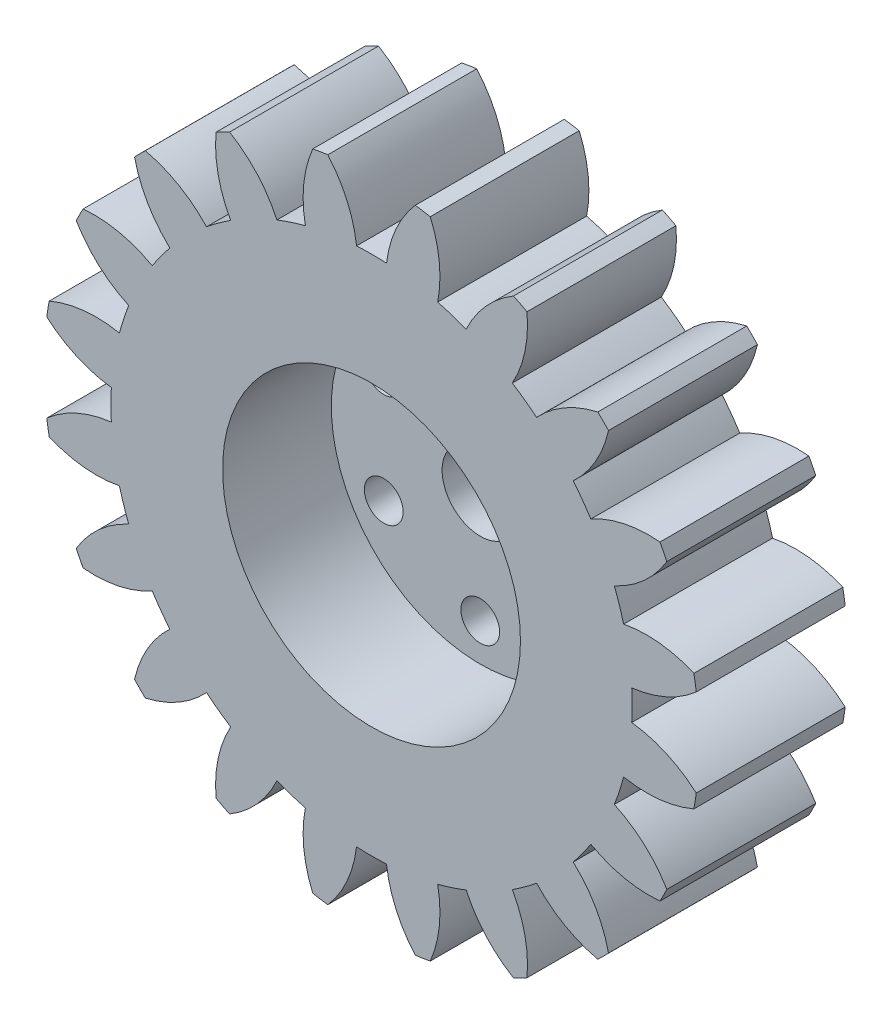
from build123d import *

# Parameters (mm, degrees)
SKETCH1_R           = 3.25
BOSS_EXTRUDE1_DEPTH = 12.7
CUT_EXTRUDE1_REACH  = 43.167
SKETCH2_R           = 1.651
SKETCH3_R           = 12.7
CUT_EXTRUDE2_DEPTH  = 9.271


with BuildPart() as part:
    # Sketch1 → Boss-Extrude1 (new body)
    with BuildSketch(Plane.XY):
        with BuildLine():
            ThreePointArc((-27.689807384, 3.730705969), (-25.124393342, 2.086949602), (-22.186968024, 1.277742146))
            ThreePointArc((-22.186968024, 1.277742146), (-22.22373, 0), (-22.186968024, -1.277742146))
            ThreePointArc((-22.186968024, -1.277742146), (-25.124393342, -2.086949602), (-27.689807384, -3.730705969))
            ThreePointArc((-27.689807384, -3.730705969), (-27.596012236, -4.370778953), (-27.487423293, -5.00850883))
            ThreePointArc((-27.487423293, -5.00850883), (-24.539620899, -5.779057498), (-21.495904554, -5.640945179))
            ThreePointArc((-21.495904554, -5.640945179), (-21.136023233, -6.867510248), (-20.706216479, -8.071355168))
            ThreePointArc((-20.706216479, -8.071355168), (-23.249815112, -9.748671534), (-25.181720202, -12.104733275))
            ThreePointArc((-25.181720202, -12.104733275), (-24.894722286, -12.684494563), (-24.594378694, -13.257455889))
            ThreePointArc((-24.594378694, -13.257455889), (-21.552739385, -13.079370185), (-18.700672175, -12.007457487))
            ThreePointArc((-18.700672175, -12.007457487), (-17.979375248, -13.062780745), (-17.198596196, -14.074887709))
            ThreePointArc((-17.198596196, -14.074887709), (-19.099382988, -16.456125574), (-20.208670796, -19.293864949))
            ThreePointArc((-20.208670796, -19.293864949), (-19.756563466, -19.756563466), (-19.293864949, -20.208670796))
            ThreePointArc((-19.293864949, -20.208670796), (-16.456125574, -19.099382988), (-14.074887709, -17.198596196))
            ThreePointArc((-14.074887709, -17.198596196), (-13.062780745, -17.979375248), (-12.007457487, -18.700672175))
            ThreePointArc((-12.007457487, -18.700672175), (-13.079370185, -21.552739385), (-13.257455889, -24.594378694))
            ThreePointArc((-13.257455889, -24.594378694), (-12.684494563, -24.894722286), (-12.104733275, -25.181720202))
            ThreePointArc((-12.104733275, -25.181720202), (-9.748671534, -23.249815112), (-8.071355168, -20.706216479))
            ThreePointArc((-8.071355168, -20.706216479), (-6.867510248, -21.136023233), (-5.640945179, -21.495904554))
            ThreePointArc((-5.640945179, -21.495904554), (-5.779057498, -24.539620899), (-5.00850883, -27.487423293))
            ThreePointArc((-5.00850883, -27.487423293), (-4.370778953, -27.596012236), (-3.730705969, -27.689807384))
            ThreePointArc((-3.730705969, -27.689807384), (-2.086949602, -25.124393342), (-1.277742146, -22.186968024))
            ThreePointArc((-1.277742146, -22.186968024), (0, -22.22373), (1.277742146, -22.186968024))
            ThreePointArc((1.277742146, -22.186968024), (2.086949602, -25.124393342), (3.730705969, -27.689807384))
            ThreePointArc((3.730705969, -27.689807384), (4.370778953, -27.596012236), (5.00850883, -27.487423293))
            ThreePointArc((5.00850883, -27.487423293), (5.779057498, -24.539620899), (5.640945179, -21.495904554))
            ThreePointArc((5.640945179, -21.495904554), (6.867510248, -21.136023233), (8.071355168, -20.706216479))
            ThreePointArc((8.071355168, -20.706216479), (9.748671534, -23.249815112), (12.104733275, -25.181720202))
            ThreePointArc((12.104733275, -25.181720202), (12.684494563, -24.894722286), (13.257455889, -24.594378694))
            ThreePointArc((13.257455889, -24.594378694), (13.079370185, -21.552739385), (12.007457487, -18.700672175))
            ThreePointArc((12.007457487, -18.700672175), (13.062780745, -17.979375248), (14.074887709, -17.198596196))
            ThreePointArc((14.074887709, -17.198596196), (16.456125574, -19.099382988), (19.293864949, -20.208670796))
            ThreePointArc((19.293864949, -20.208670796), (19.756563466, -19.756563466), (20.208670796, -19.293864949))
            ThreePointArc((20.208670796, -19.293864949), (19.099382988, -16.456125574), (17.198596196, -14.074887709))
            ThreePointArc((17.198596196, -14.074887709), (17.979375248, -13.062780745), (18.700672175, -12.007457487))
            ThreePointArc((18.700672175, -12.007457487), (21.552739385, -13.079370185), (24.594378694, -13.257455889))
            ThreePointArc((24.594378694, -13.257455889), (24.894722286, -12.684494563), (25.181720202, -12.104733275))
            ThreePointArc((25.181720202, -12.104733275), (23.249815112, -9.748671534), (20.706216479, -8.071355168))
            ThreePointArc((20.706216479, -8.071355168), (21.136023233, -6.867510248), (21.495904554, -5.640945179))
            ThreePointArc((21.495904554, -5.640945179), (24.539620899, -5.779057498), (27.487423293, -5.00850883))
            ThreePointArc((27.487423293, -5.00850883), (27.596012236, -4.370778953), (27.689807384, -3.730705969))
            ThreePointArc((27.689807384, -3.730705969), (25.124393342, -2.086949602), (22.186968024, -1.277742146))
            ThreePointArc((22.186968024, -1.277742146), (22.22373, 0), (22.186968024, 1.277742146))
            ThreePointArc((22.186968024, 1.277742146), (25.124393342, 2.086949602), (27.689807384, 3.730705969))
            ThreePointArc((27.689807384, 3.730705969), (27.596012236, 4.370778953), (27.487423293, 5.00850883))
            ThreePointArc((27.487423293, 5.00850883), (24.539620899, 5.779057498), (21.495904554, 5.640945179))
            ThreePointArc((21.495904554, 5.640945179), (21.136023233, 6.867510248), (20.706216479, 8.071355168))
            ThreePointArc((20.706216479, 8.071355168), (23.249815112, 9.748671534), (25.181720202, 12.104733275))
            ThreePointArc((25.181720202, 12.104733275), (24.894722286, 12.684494563), (24.594378694, 13.257455889))
            ThreePointArc((24.594378694, 13.257455889), (21.552739385, 13.079370185), (18.700672175, 12.007457487))
            ThreePointArc((18.700672175, 12.007457487), (17.979375248, 13.062780745), (17.198596196, 14.074887709))
            ThreePointArc((17.198596196, 14.074887709), (19.099382988, 16.456125574), (20.208670796, 19.293864949))
            ThreePointArc((20.208670796, 19.293864949), (19.756563466, 19.756563466), (19.293864949, 20.208670796))
            ThreePointArc((19.293864949, 20.208670796), (16.456125574, 19.099382988), (14.074887709, 17.198596196))
            ThreePointArc((14.074887709, 17.198596196), (13.062780745, 17.979375248), (12.007457487, 18.700672175))
            ThreePointArc((12.007457487, 18.700672175), (13.079370185, 21.552739385), (13.257455889, 24.594378694))
            ThreePointArc((13.257455889, 24.594378694), (12.684494563, 24.894722286), (12.104733275, 25.181720202))
            ThreePointArc((12.104733275, 25.181720202), (9.748671534, 23.249815112), (8.071355168, 20.706216479))
            ThreePointArc((8.071355168, 20.706216479), (6.867510248, 21.136023233), (5.640945179, 21.495904554))
            ThreePointArc((5.640945179, 21.495904554), (5.779057498, 24.539620899), (5.00850883, 27.487423293))
            ThreePointArc((5.00850883, 27.487423293), (4.370778953, 27.596012236), (3.730705969, 27.689807384))
            ThreePointArc((3.730705969, 27.689807384), (2.086949602, 25.124393342), (1.277742146, 22.186968024))
            ThreePointArc((1.277742146, 22.186968024), (0, 22.22373), (-1.277742146, 22.186968024))
            ThreePointArc((-1.277742146, 22.186968024), (-2.086949602, 25.124393342), (-3.730705969, 27.689807384))
            ThreePointArc((-3.730705969, 27.689807384), (-4.370778953, 27.596012236), (-5.00850883, 27.487423293))
            ThreePointArc((-5.00850883, 27.487423293), (-5.779057498, 24.539620899), (-5.640945179, 21.495904554))
            ThreePointArc((-5.640945179, 21.495904554), (-6.867510248, 21.136023233), (-8.071355168, 20.706216479))
            ThreePointArc((-8.071355168, 20.706216479), (-9.748671534, 23.249815112), (-12.104733275, 25.181720202))
            ThreePointArc((-12.104733275, 25.181720202), (-12.684494563, 24.894722286), (-13.257455889, 24.594378694))
            ThreePointArc((-13.257455889, 24.594378694), (-13.079370185, 21.552739385), (-12.007457487, 18.700672175))
            ThreePointArc((-12.007457487, 18.700672175), (-13.062780745, 17.979375248), (-14.074887709, 17.198596196))
            ThreePointArc((-14.074887709, 17.198596196), (-16.456125574, 19.099382988), (-19.293864949, 20.208670796))
            ThreePointArc((-19.293864949, 20.208670796), (-19.756563466, 19.756563466), (-20.208670796, 19.293864949))
            ThreePointArc((-20.208670796, 19.293864949), (-19.099382988, 16.456125574), (-17.198596196, 14.074887709))
            ThreePointArc((-17.198596196, 14.074887709), (-17.979375248, 13.062780745), (-18.700672175, 12.007457487))
            ThreePointArc((-18.700672175, 12.007457487), (-21.552739385, 13.079370185), (-24.594378694, 13.257455889))
            ThreePointArc((-24.594378694, 13.257455889), (-24.894722286, 12.684494563), (-25.181720202, 12.104733275))
            ThreePointArc((-25.181720202, 12.104733275), (-23.249815112, 9.748671534), (-20.706216479, 8.071355168))
            ThreePointArc((-20.706216479, 8.071355168), (-21.136023233, 6.867510248), (-21.495904554, 5.640945179))
            ThreePointArc((-21.495904554, 5.640945179), (-24.539620899, 5.779057498), (-27.487423293, 5.00850883))
            ThreePointArc((-27.487423293, 5.00850883), (-27.596012236, 4.370778953), (-27.689807384, 3.730705969))
        make_face()
        Circle(SKETCH1_R, mode=Mode.SUBTRACT)
    extrude(amount=BOSS_EXTRUDE1_DEPTH)

    # Sketch2 → Cut-Extrude1 (cut, up to next)
    with BuildSketch(Plane.XY.offset(12.7), mode=Mode.PRIVATE) as cut_extrude1_sk1:
        with Locations((0, 9.5)):
            Circle(SKETCH2_R)
    cut_extrude1_tool1 = extrude(cut_extrude1_sk1.sketch, amount=-CUT_EXTRUDE1_REACH, mode=Mode.PRIVATE) & part.part
    # Sketch2 → Cut-Extrude1 (cut, up to next)
    with BuildSketch(Plane.XY.offset(12.7), mode=Mode.PRIVATE) as cut_extrude1_sk2:
        with Locations((8.227241336, 4.75)):
            Circle(SKETCH2_R)
    cut_extrude1_tool2 = extrude(cut_extrude1_sk2.sketch, amount=-CUT_EXTRUDE1_REACH, mode=Mode.PRIVATE) & part.part
    # Sketch2 → Cut-Extrude1 (cut, up to next)
    with BuildSketch(Plane.XY.offset(12.7), mode=Mode.PRIVATE) as cut_extrude1_sk3:
        with Locations((8.227241336, -4.75)):
            Circle(SKETCH2_R)
    cut_extrude1_tool3 = extrude(cut_extrude1_sk3.sketch, amount=-CUT_EXTRUDE1_REACH, mode=Mode.PRIVATE) & part.part
    # Sketch2 → Cut-Extrude1 (cut, up to next)
    with BuildSketch(Plane.XY.offset(12.7), mode=Mode.PRIVATE) as cut_extrude1_sk4:
        with Locations((0, -9.5)):
            Circle(SKETCH2_R)
    cut_extrude1_tool4 = extrude(cut_extrude1_sk4.sketch, amount=-CUT_EXTRUDE1_REACH, mode=Mode.PRIVATE) & part.part
    # Sketch2 → Cut-Extrude1 (cut, up to next)
    with BuildSketch(Plane.XY.offset(12.7), mode=Mode.PRIVATE) as cut_extrude1_sk5:
        with Locations((-8.227241336, -4.75)):
            Circle(SKETCH2_R)
    cut_extrude1_tool5 = extrude(cut_extrude1_sk5.sketch, amount=-CUT_EXTRUDE1_REACH, mode=Mode.PRIVATE) & part.part
    # Sketch2 → Cut-Extrude1 (cut, up to next)
    with BuildSketch(Plane.XY.offset(12.7), mode=Mode.PRIVATE) as cut_extrude1_sk6:
        with Locations((-8.227241336, 4.75)):
            Circle(SKETCH2_R)
    cut_extrude1_tool6 = extrude(cut_extrude1_sk6.sketch, amount=-CUT_EXTRUDE1_REACH, mode=Mode.PRIVATE) & part.part
    add(cut_extrude1_tool1.solids().sort_by_distance((0, 9.5, 12.7))[0], mode=Mode.SUBTRACT)
    add(cut_extrude1_tool2.solids().sort_by_distance((8.227241, 4.75, 12.7))[0], mode=Mode.SUBTRACT)
    add(cut_extrude1_tool3.solids().sort_by_distance((8.227241, -4.75, 12.7))[0], mode=Mode.SUBTRACT)
    add(cut_extrude1_tool4.solids().sort_by_distance((0, -9.5, 12.7))[0], mode=Mode.SUBTRACT)
    add(cut_extrude1_tool5.solids().sort_by_distance((-8.227241, -4.75, 12.7))[0], mode=Mode.SUBTRACT)
    add(cut_extrude1_tool6.solids().sort_by_distance((-8.227241, 4.75, 12.7))[0], mode=Mode.SUBTRACT)

    # Sketch3 → Cut-Extrude2 (cut)
    with BuildSketch(Plane.XY.offset(12.7)):
        Circle(SKETCH3_R)
    extrude(amount=-CUT_EXTRUDE2_DEPTH, mode=Mode.SUBTRACT)


solid = part.part
